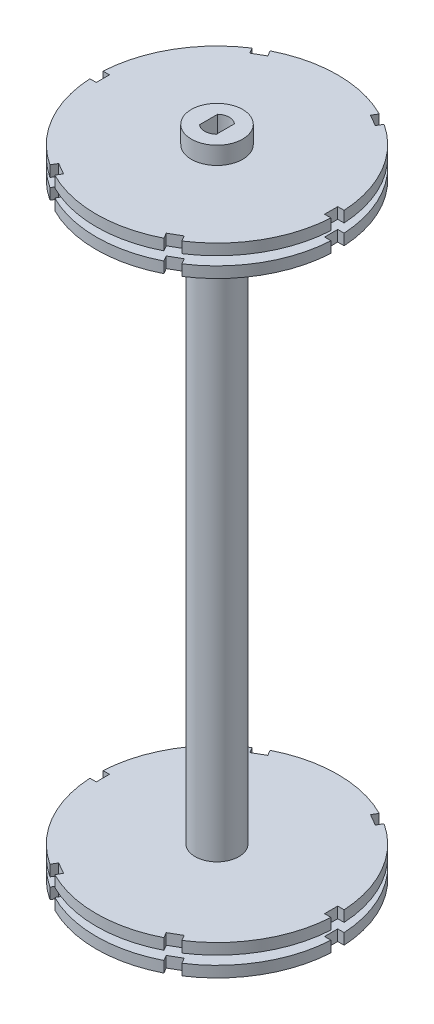
from build123d import *

# Parameters (mm, degrees)
BOSS_EXTRUDE1_DEPTH     = 6.5
SKETCH2_R               = 27.5
BOSS_EXTRUDE2_DEPTH     = 2.5
CUT_EXTRUDE1_DEPTH      = 8
SKETCH4_W               = 3
SKETCH4_H               = 3
CUT_EXTRUDE2_DEPTH      = 10
SKETCH5_R               = 5
BOSS_EXTRUDE3_DEPTH     = 140
CUT_EXTRUDE3_DEPTH      = 15
MIRROR6_COPY_1_SKETCH_R = 27.5
MIRROR6_COPY_1_DEPTH    = 2.5
MIRROR6_COPY_2_SKETCH_W = 3
MIRROR6_COPY_2_SKETCH_H = 3
MIRROR6_COPY_2_DEPTH    = 10


with BuildPart() as part:
    # Sketch1 → Boss-Extrude1 (new body)
    with BuildSketch(Plane(origin=(0, 0, 0), x_dir=(1, 0, 0), z_dir=(0, 1, 0))):
        with BuildLine():
            ThreePointArc((-1.9, -2.05669638), (-2.8, 0), (-1.9, 2.05669638))
            Line((-1.9, 2.05669638), (-1.9, 5.532856405))
            ThreePointArc((-1.9, 5.532856405), (-5.85, 0), (-1.9, -5.532856405))
            Line((-1.9, -5.532856405), (-1.9, -2.05669638))
        make_face()
        with BuildLine():
            ThreePointArc((-1.9, 2.05669638), (0, 2.8), (1.9, 2.05669638))
            Line((1.9, 2.05669638), (1.9, 5.532856405))
            ThreePointArc((1.9, 5.532856405), (0, 5.85), (-1.9, 5.532856405))
            Line((-1.9, 5.532856405), (-1.9, 2.05669638))
        make_face()
        with BuildLine():
            Line((1.9, 5.532856405), (1.9, 2.05669638))
            ThreePointArc((1.9, 2.05669638), (2.565151068, 1.122497216), (2.8, 0))
            ThreePointArc((2.8, 0), (2.565151068, -1.122497216), (1.9, -2.05669638))
            Line((1.9, -2.05669638), (1.9, -5.532856405))
            ThreePointArc((1.9, -5.532856405), (4.761171074, -3.399080758), (5.85, 0))
            ThreePointArc((5.85, 0), (4.761171074, 3.399080758), (1.9, 5.532856405))
        make_face()
        with BuildLine():
            Line((1.9, -5.532856405), (1.9, -2.05669638))
            ThreePointArc((1.9, -2.05669638), (0, -2.8), (-1.9, -2.05669638))
            Line((-1.9, -2.05669638), (-1.9, -5.532856405))
            ThreePointArc((-1.9, -5.532856405), (0, -5.85), (1.9, -5.532856405))
        make_face()
        with BuildLine():
            Line((-1.9, -2.05669638), (-1.9, 2.05669638))
            ThreePointArc((-1.9, 2.05669638), (-2.8, 0), (-1.9, -2.05669638))
        make_face()
        with BuildLine():
            ThreePointArc((2.8, 0), (2.565151068, 1.122497216), (1.9, 2.05669638))
            Line((1.9, 2.05669638), (1.9, -2.05669638))
            ThreePointArc((1.9, -2.05669638), (2.565151068, -1.122497216), (2.8, 0))
        make_face()
    boss_extrude1 = extrude(amount=BOSS_EXTRUDE1_DEPTH)

    # Sketch2 → Boss-Extrude2 (add)
    with BuildSketch(Plane(origin=(0, 6.5, 0), x_dir=(1, 0, 0), z_dir=(0, 1, 0))):
        with Locations(Location((0, 0, 0), (0, 0, 270))):
            Circle(SKETCH2_R)
    boss_extrude2 = extrude(amount=-BOSS_EXTRUDE2_DEPTH)

    # Sketch3 → Cut-Extrude1 (cut)
    with BuildSketch(Plane.XZ.offset(-4)):
        with BuildLine():
            Line((-1.9, 2.05669638), (-1.9, -2.05669638))
            ThreePointArc((-1.9, -2.05669638), (0, -2.8), (1.9, -2.05669638))
            Line((1.9, -2.05669638), (1.9, 2.05669638))
            ThreePointArc((1.9, 2.05669638), (0, 2.8), (-1.9, 2.05669638))
        make_face()
    cut_extrude1 = extrude(amount=-CUT_EXTRUDE1_DEPTH, mode=Mode.SUBTRACT)

    # Sketch4 → Cut-Extrude2 (cut)
    with BuildSketch(Plane(origin=(0, 6.5, 0), x_dir=(1, 0, 0), z_dir=(0, 1, 0))):
        Polygon((14.299038106, -21.766660498), (15.799038106, -24.36473671), (13.200961894, -25.86473671), (11.700961894, -23.266660498), align=None)
        with Locations((27.5, 0)):
            Rectangle(SKETCH4_W, SKETCH4_H)
        Polygon((-11.700961894, -23.266660498), (-13.200961894, -25.86473671), (-15.799038106, -24.36473671), (-14.299038106, -21.766660498), align=None)
        with Locations((-27.5, 0)):
            Rectangle(SKETCH4_W, SKETCH4_H)
        Polygon((-14.299038106, 21.766660498), (-15.799038106, 24.36473671), (-13.200961894, 25.86473671), (-11.700961894, 23.266660498), align=None)
        Polygon((11.700961894, 23.266660498), (13.200961894, 25.86473671), (15.799038106, 24.36473671), (14.299038106, 21.766660498), align=None)
    cut_extrude2 = extrude(amount=-CUT_EXTRUDE2_DEPTH, mode=Mode.SUBTRACT)

    # Sketch5 → Boss-Extrude3 (add)
    with BuildSketch(Plane(origin=(0, 6.5, 0), x_dir=(1, 0, 0), z_dir=(0, 1, 0))):
        with Locations(Location((0, 0, 0), (0, 0, 270))):
            Circle(SKETCH5_R)
    extrude(amount=BOSS_EXTRUDE3_DEPTH)

    # Mirror1: Boss-Extrude2 across plane
    add(boss_extrude2.mirror(Plane.ZX.offset(76.5)))

    # Mirror2: Boss-Extrude1 across plane
    add(boss_extrude1.mirror(Plane.ZX.offset(76.5)))

    # Mirror3: Boss-Extrude2, Cut-Extrude1, Cut-Extrude2 across plane
    add(boss_extrude2.mirror(Plane.ZX.offset(7.5)))
    add(cut_extrude1.mirror(Plane.ZX.offset(7.5)), mode=Mode.SUBTRACT)
    add(cut_extrude2.mirror(Plane.ZX.offset(7.5)), mode=Mode.SUBTRACT)

    # Sketch6 → Cut-Extrude3 (cut)
    with BuildSketch(Plane.XZ.offset(-11)):
        with BuildLine():
            Line((-1.9, 2.05669638), (-1.9, -2.05669638))
            ThreePointArc((-1.9, -2.05669638), (0, -2.8), (1.9, -2.05669638))
            Line((1.9, -2.05669638), (1.9, 2.05669638))
            ThreePointArc((1.9, 2.05669638), (0, 2.8), (-1.9, 2.05669638))
        make_face()
    extrude(amount=-CUT_EXTRUDE3_DEPTH, mode=Mode.SUBTRACT)

    # Mirror5: Cut-Extrude2 across plane
    add(cut_extrude2.mirror(Plane.ZX.offset(76.5)), mode=Mode.SUBTRACT)

    # Mirror6 copy 1 sketch → Mirror6 copy 1 (add)
    with BuildSketch(Plane(origin=(0, 144.5, 0), x_dir=(1, 0, 0), z_dir=(0, 1, 0))):
        with Locations(Location((0, 0, 0), (0, 0, 270))):
            Circle(MIRROR6_COPY_1_SKETCH_R)
    extrude(amount=-MIRROR6_COPY_1_DEPTH)

    # Mirror6 copy 2 sketch → Mirror6 copy 2 (cut)
    with BuildSketch(Plane(origin=(0, 144.5, 0), x_dir=(1, 0, 0), z_dir=(0, 1, 0))):
        Polygon((14.299038106, -21.766660498), (15.799038106, -24.36473671), (13.200961894, -25.86473671), (11.700961894, -23.266660498), align=None)
        with Locations((27.5, 0)):
            Rectangle(MIRROR6_COPY_2_SKETCH_W, MIRROR6_COPY_2_SKETCH_H)
        Polygon((-11.700961894, -23.266660498), (-13.200961894, -25.86473671), (-15.799038106, -24.36473671), (-14.299038106, -21.766660498), align=None)
        with Locations((-27.5, 0)):
            Rectangle(MIRROR6_COPY_2_SKETCH_W, MIRROR6_COPY_2_SKETCH_H)
        Polygon((-14.299038106, 21.766660498), (-15.799038106, 24.36473671), (-13.200961894, 25.86473671), (-11.700961894, 23.266660498), align=None)
        Polygon((11.700961894, 23.266660498), (13.200961894, 25.86473671), (15.799038106, 24.36473671), (14.299038106, 21.766660498), align=None)
    extrude(amount=-MIRROR6_COPY_2_DEPTH, mode=Mode.SUBTRACT)


solid = part.part
